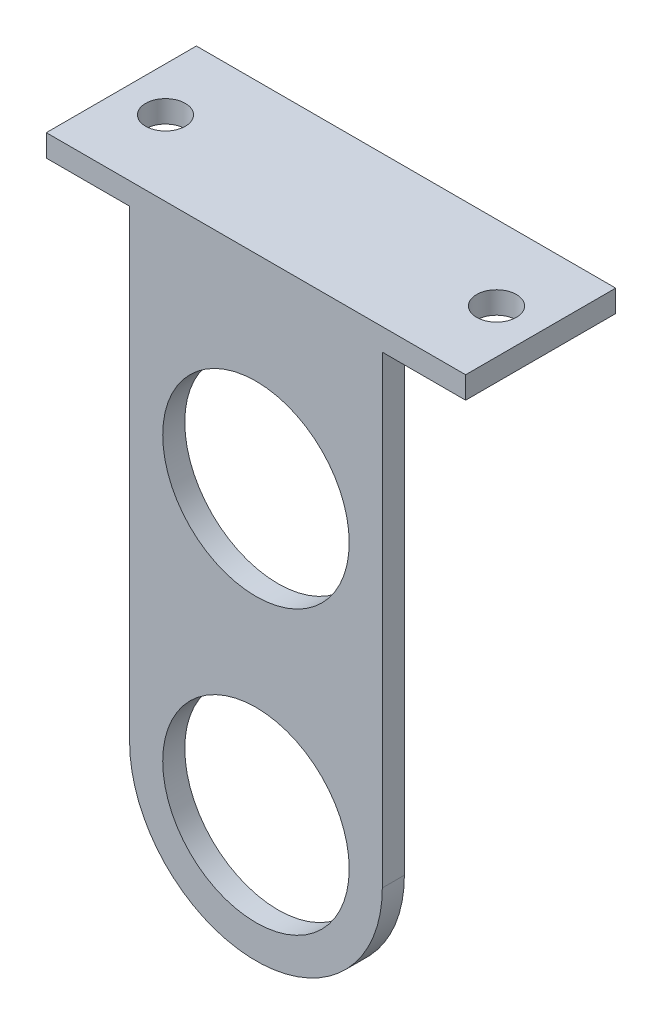
from build123d import *

# Parameters (mm, degrees)
SKETCH1_R           = 8.45
BOSS_EXTRUDE1_DEPTH = 1
SKETCH4_W           = 38
SKETCH4_H           = 13.6
SKETCH4_R           = 1.8
BOSS_EXTRUDE2_DEPTH = 2


with BuildPart() as part:
    # Sketch1 → Boss-Extrude1 (new, symmetric)
    with BuildSketch(Plane.XY):
        with BuildLine():
            Line((-11.45, -12.8), (-11.45, 29.25))
            Line((-11.45, 29.25), (11.45, 29.25))
            Line((11.45, 29.25), (11.45, -12.8))
            ThreePointArc((11.45, -12.8), (0, -24.25), (-11.45, -12.8))
        make_face()
        with Locations((0, 12.8)):
            Circle(SKETCH1_R, mode=Mode.SUBTRACT)
        with Locations(Location((0, -12.8, 0), (0, 0, 180))):
            Circle(SKETCH1_R, mode=Mode.SUBTRACT)
    extrude(amount=BOSS_EXTRUDE1_DEPTH, both=True)

    # Sketch4 → Boss-Extrude2 (add)
    with BuildSketch(Plane(origin=(0, 29.25, 0), x_dir=(1, 0, 0), z_dir=(0, 1, 0))):
        with Locations((0, 5.8)):
            Rectangle(SKETCH4_W, SKETCH4_H)
        with Locations(Location((-15, 5.8, 0), (0, 0, 180))):
            Circle(SKETCH4_R, mode=Mode.SUBTRACT)
        with Locations((15, 5.8)):
            Circle(SKETCH4_R, mode=Mode.SUBTRACT)
    extrude(amount=BOSS_EXTRUDE2_DEPTH)


solid = part.part
